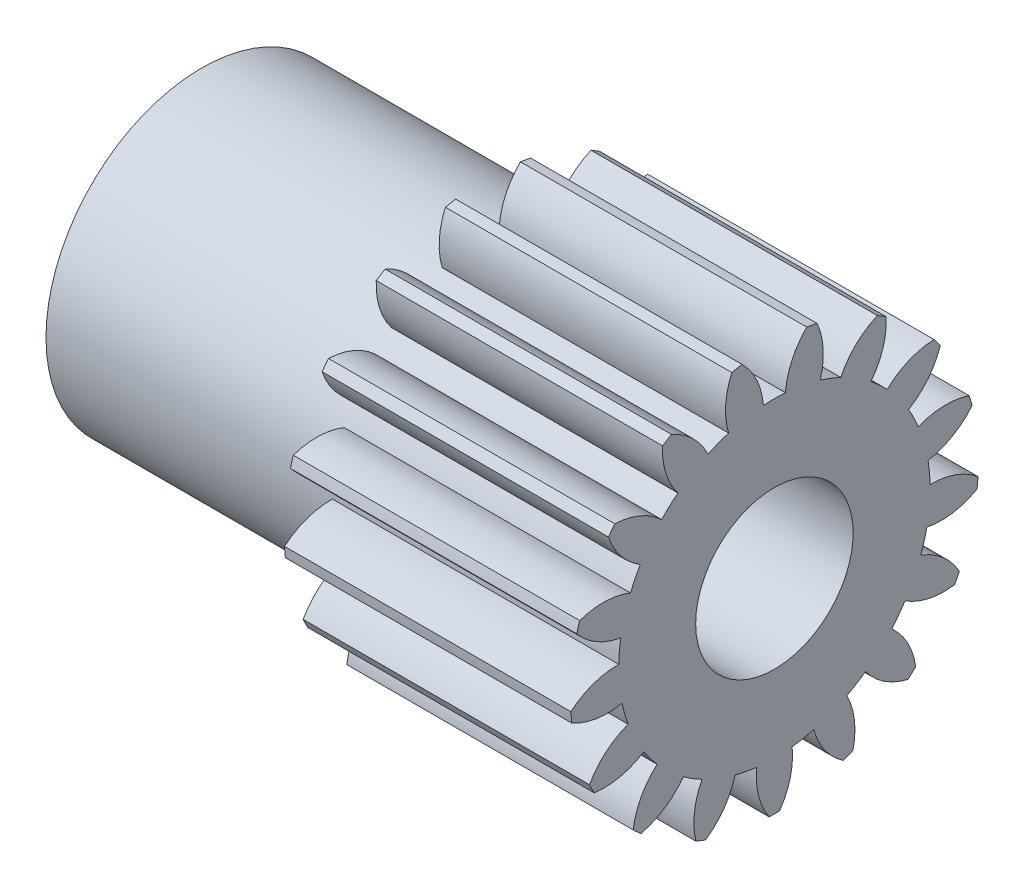
from build123d import *
from build123d.topology import SkipClean

# Parameters (mm, degrees)
BASPROSKE_W      = 20
BASPROSKE_H      = 14.25
TOOTHCUT_DEPTH   = 29.392340516
TEETHCUTS_COUNT  = 17
TEETHCUTS_ANGLE  = 338.823529412
HUBNEARONE_START = 20.0000508
HUBNEAONESKE_R   = 10.874
HUBNEARONE_DEPTH = 20.0000508
BORSKE_R         = 5.5
BORE_DEPTH       = 40.0000508


with BuildPart() as part:
    # BasProSke → Base-Revolve (revolve)
    with BuildSketch(Plane(origin=(0, 0, 0), x_dir=(1, 0, 0), z_dir=(0, 1, 0)), mode=Mode.PRIVATE) as base_revolve_sk:
        with Locations((10, 7.125)):
            Rectangle(BASPROSKE_W, BASPROSKE_H)
    revolve(base_revolve_sk.sketch.rotate(Axis((-10, 0, 0), (1, 0, 0)), 180), axis=Axis((-10, 0, 0), (1, 0, 0)))

    # TooCutSke → ToothCut (cut, through all)
    with BuildSketch(Plane(origin=(0, 0, 0), x_dir=(0, 0, -1), z_dir=(1, 0, 0))):
        with BuildLine():
            ThreePointArc((0.769354207, 10.846749287), (0, 10.874), (-0.769354207, 10.846749287))
            ThreePointArc((-0.769354207, 10.846749287), (-1.230849554, 12.606357238), (-2.280560064, 14.092057726))
            ThreePointArc((-2.280560064, 14.092057726), (0, 14.2754), (2.280560064, 14.092057726))
            ThreePointArc((2.280560064, 14.092057726), (1.230849554, 12.606357238), (0.769354207, 10.846749287))
        make_face()
    toothcut = extrude(amount=TOOTHCUT_DEPTH, mode=Mode.SUBTRACT)

    # TeethCuts: ToothCut ×17 about axis
    teethcuts_axis = Axis((-10, 0, 0), (1, 0, 0))
    for i in range(1, TEETHCUTS_COUNT):
        add(toothcut.rotate(teethcuts_axis, i * TEETHCUTS_ANGLE / (TEETHCUTS_COUNT - 1)), mode=Mode.SUBTRACT)

    # HubNeaOneSke → HubNearOne (add)
    with SkipClean():  # the faces are left unmerged after this step: merging them gives an invalid solid
        with BuildSketch(Plane.ZY.offset(HUBNEARONE_START)):
            Circle(HUBNEAONESKE_R)
        extrude(amount=-HUBNEARONE_DEPTH)

    # BorSke → Bore (cut, symmetric)
    with SkipClean():  # the faces are left unmerged after this step: merging them gives an invalid solid
        with BuildSketch(Plane(origin=(0, 0, 0), x_dir=(0, 0, -1), z_dir=(1, 0, 0))):
            with Locations(Location((0, 0, 0), (0, 0, 180))):
                Circle(BORSKE_R)
        extrude(amount=BORE_DEPTH, both=True, mode=Mode.SUBTRACT)


solid = part.part
